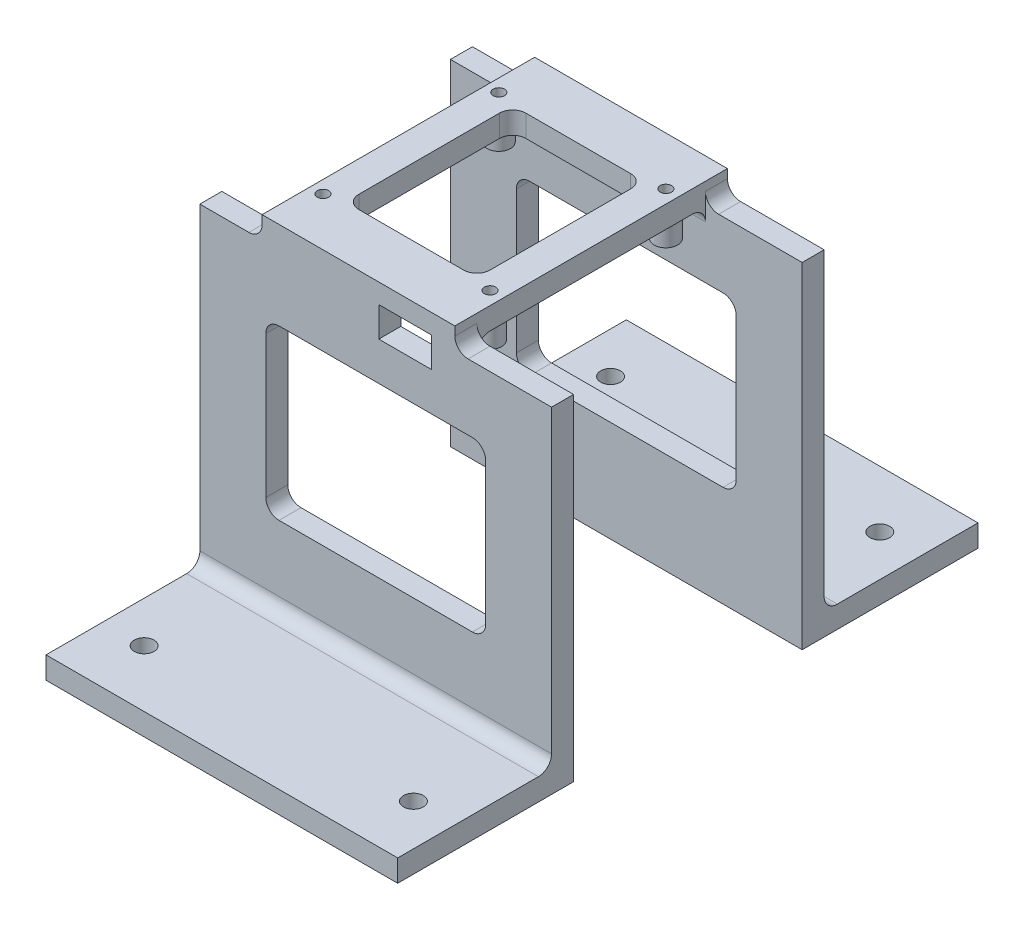
from build123d import *

# Parameters (mm, degrees)
SKETCH1_W               = 80
SKETCH1_H               = 40
SKETCH1_R               = 2.25
BOSS_EXTRUDE1_DEPTH     = 5
BOSS_EXTRUDE1_2_DEPTH   = 5
SKETCH2_W               = 80
SKETCH2_H               = 5
BOSS_EXTRUDE2_DEPTH     = 71.3
SKETCH3_W               = 43.85
SKETCH3_H               = 62
BOSS_EXTRUDE3_DEPTH     = 5
SKETCH5_W               = 29.85
SKETCH5_H               = 38
CUT_EXTRUDE2_DEPTH      = 10
CUT_EXTRUDE1_REACH      = 114.097
SKETCH4_R               = 1.3
FILLET1_R               = 3
FILLET2_R               = 3
CUT_EXTRUDE3_DEPTH      = 133.735413511
CUT_EXTRUDE3_DEPTH_BACK = 133.735413511
SKETCH6_W               = 50
SKETCH6_H               = 38.3
FILLET3_R               = 3
SKETCH9_R               = 2.65
SKETCH9_R_2             = 1.05
BOSS_EXTRUDE5_DEPTH     = 4.75
SKETCH10_W              = 12
SKETCH10_H              = 6.8
CUT_EXTRUDE4_DEPTH      = 8


with BuildPart() as part:
    # Sketch1 → Boss-Extrude1 (new body)
    with BuildSketch(Plane(origin=(0, 0, 0), x_dir=(1, 0, 0), z_dir=(0, 1, 0))):
        with Locations((0, 46)):
            Rectangle(SKETCH1_W, SKETCH1_H)
        with Locations(Location((-30.625, 53.044055982, 0), (0, 0, 270))):
            Circle(SKETCH1_R, mode=Mode.SUBTRACT)
        with Locations(Location((30.625, 53.044055982, 0), (0, 0, 90))):
            Circle(SKETCH1_R, mode=Mode.SUBTRACT)
    extrude(amount=BOSS_EXTRUDE1_DEPTH)



with BuildPart() as body_2:
    # Sketch1 → Boss-Extrude1 2 (new body)
    with BuildSketch(Plane(origin=(0, 0, 0), x_dir=(1, 0, 0), z_dir=(0, 1, 0))):
        with Locations((0, -46)):
            Rectangle(SKETCH1_W, SKETCH1_H)
        with Locations(Location((30.625, -53.044055982, 0), (0, 0, 270))):
            Circle(SKETCH1_R, mode=Mode.SUBTRACT)
        with Locations(Location((-30.625, -53.044055982, 0), (0, 0, 90))):
            Circle(SKETCH1_R, mode=Mode.SUBTRACT)
    extrude(amount=BOSS_EXTRUDE1_2_DEPTH)


with BuildPart() as part_1:
    add(part.part)

    add(body_2.part)  # Boss-Extrude2 merges body 2
    # Sketch2 → Boss-Extrude2 (add)
    with BuildSketch(Plane(origin=(0, 5, 0), x_dir=(1, 0, 0), z_dir=(0, 1, 0))):
        with Locations((0, 28.5)):
            Rectangle(SKETCH2_W, SKETCH2_H)
        with Locations((0, -28.5)):
            Rectangle(SKETCH2_W, SKETCH2_H)
    extrude(amount=BOSS_EXTRUDE2_DEPTH)

    # Sketch3 → Boss-Extrude3 (add)
    with BuildSketch(Plane(origin=(0, 76.3, 0), x_dir=(1, 0, 0), z_dir=(0, 1, 0))):
        with Locations((-3.925, 0)):
            Rectangle(SKETCH3_W, SKETCH3_H)
    extrude(amount=BOSS_EXTRUDE3_DEPTH)

    # Sketch5 → Cut-Extrude2 (cut)
    with BuildSketch(Plane.XZ.offset(-76.3)):
        with Locations((-3.925, 0)):
            Rectangle(SKETCH5_W, SKETCH5_H)
    extrude(amount=-CUT_EXTRUDE2_DEPTH, mode=Mode.SUBTRACT)

    # Sketch4 → Cut-Extrude1 (cut, up to next)
    with BuildSketch(Plane(origin=(0, 81.3, 0), x_dir=(1, 0, 0), z_dir=(0, 1, 0)), mode=Mode.PRIVATE) as cut_extrude1_sk1:
        with Locations(Location((-23, 20, 0), (0, 0, 270))):
            Circle(SKETCH4_R)
    cut_extrude1_tool1 = extrude(cut_extrude1_sk1.sketch, amount=-CUT_EXTRUDE1_REACH, mode=Mode.PRIVATE) & part_1.part
    # Sketch4 → Cut-Extrude1 (cut, up to next)
    with BuildSketch(Plane(origin=(0, 81.3, 0), x_dir=(1, 0, 0), z_dir=(0, 1, 0)), mode=Mode.PRIVATE) as cut_extrude1_sk2:
        with Locations(Location((15, 20, 0), (0, 0, 270))):
            Circle(SKETCH4_R)
    cut_extrude1_tool2 = extrude(cut_extrude1_sk2.sketch, amount=-CUT_EXTRUDE1_REACH, mode=Mode.PRIVATE) & part_1.part
    # Sketch4 → Cut-Extrude1 (cut, up to next)
    with BuildSketch(Plane(origin=(0, 81.3, 0), x_dir=(1, 0, 0), z_dir=(0, 1, 0)), mode=Mode.PRIVATE) as cut_extrude1_sk3:
        with Locations(Location((15, -20, 0), (0, 0, 270))):
            Circle(SKETCH4_R)
    cut_extrude1_tool3 = extrude(cut_extrude1_sk3.sketch, amount=-CUT_EXTRUDE1_REACH, mode=Mode.PRIVATE) & part_1.part
    # Sketch4 → Cut-Extrude1 (cut, up to next)
    with BuildSketch(Plane(origin=(0, 81.3, 0), x_dir=(1, 0, 0), z_dir=(0, 1, 0)), mode=Mode.PRIVATE) as cut_extrude1_sk4:
        with Locations(Location((-23, -20, 0), (0, 0, 270))):
            Circle(SKETCH4_R)
    cut_extrude1_tool4 = extrude(cut_extrude1_sk4.sketch, amount=-CUT_EXTRUDE1_REACH, mode=Mode.PRIVATE) & part_1.part
    add(cut_extrude1_tool1.solids().sort_by_distance((-23, 81.3, -20))[0], mode=Mode.SUBTRACT)
    add(cut_extrude1_tool2.solids().sort_by_distance((15, 81.3, -20))[0], mode=Mode.SUBTRACT)
    add(cut_extrude1_tool3.solids().sort_by_distance((15, 81.3, 20))[0], mode=Mode.SUBTRACT)
    add(cut_extrude1_tool4.solids().sort_by_distance((-23, 81.3, 20))[0], mode=Mode.SUBTRACT)

    # Fillet1
    fillet1_edges = [part_1.edges().sort_by_distance(p)[0] for p in [
        (0, 5, -31),
        (-3.925, 76.3, -26),
        (-3.925, 76.3, 26),
        (0, 5, 31),
    ]]
    fillet(fillet1_edges, radius=FILLET1_R)

    # Fillet2
    fillet2_edges = [part_1.edges().sort_by_distance(p)[0] for p in [
        (18, 76.3, -28.5),
        (-25.85, 76.3, -28.5),
        (-25.85, 76.3, 28.5),
        (18, 76.3, 28.5),
    ]]
    fillet(fillet2_edges, radius=FILLET2_R)

    # Sketch6 → Cut-Extrude3 (cut, two sides: drawn at the far end of the back side and taken through both)
    with BuildSketch(Plane.XY.offset(31).offset(-CUT_EXTRUDE3_DEPTH_BACK)):
        with Locations((0, 42.15)):
            Rectangle(SKETCH6_W, SKETCH6_H)
    extrude(amount=CUT_EXTRUDE3_DEPTH + CUT_EXTRUDE3_DEPTH_BACK, mode=Mode.SUBTRACT)

    # Fillet3
    fillet3_edges = [part_1.edges().sort_by_distance(p)[0] for p in [
        (-25, 61.3, -28.5),
        (-25, 61.3, 28.5),
        (-25, 23, -28.5),
        (-25, 23, 28.5),
        (25, 23, -28.5),
        (25, 23, 28.5),
        (25, 61.3, -28.5),
        (25, 61.3, 28.5),
        (-18.85, 78.8, -19),
        (-18.85, 78.8, 19),
        (11, 78.8, 19),
        (11, 78.8, -19),
    ]]
    fillet(fillet3_edges, radius=FILLET3_R)

    # Sketch9 → Boss-Extrude5 (add)
    # profile 1 of 4: a face of its own
    with BuildSketch(Plane.XZ.offset(-76.3)):
        with Locations(Location((-23, 20, 0), (0, 0, 270))):
            Circle(SKETCH9_R)
        with Locations(Location((-23, 20, 0), (0, 0, 270))):
            Circle(SKETCH9_R_2, mode=Mode.SUBTRACT)
    # profile 2 of 4: a face of its own
    with BuildSketch(Plane.XZ.offset(-76.3)):
        with Locations(Location((-23, -20, 0), (0, 0, 270))):
            Circle(SKETCH9_R)
        with Locations(Location((-23, -20, 0), (0, 0, 270))):
            Circle(SKETCH9_R_2, mode=Mode.SUBTRACT)
    # profile 3 of 4: a face of its own
    with BuildSketch(Plane.XZ.offset(-76.3)):
        with Locations(Location((15, 20, 0), (0, 0, 270))):
            Circle(SKETCH9_R)
        with Locations(Location((15, 20, 0), (0, 0, 270))):
            Circle(SKETCH9_R_2, mode=Mode.SUBTRACT)
    # profile 4 of 4: a face of its own
    with BuildSketch(Plane.XZ.offset(-76.3)):
        with Locations(Location((15, -20, 0), (0, 0, 270))):
            Circle(SKETCH9_R)
        with Locations(Location((15, -20, 0), (0, 0, 270))):
            Circle(SKETCH9_R_2, mode=Mode.SUBTRACT)
    extrude(amount=BOSS_EXTRUDE5_DEPTH)

    # Sketch10 → Cut-Extrude4 (cut)
    with BuildSketch(Plane.XY.offset(31)):
        with Locations((6.7, 73.45)):
            Rectangle(SKETCH10_W, SKETCH10_H)
    extrude(amount=-CUT_EXTRUDE4_DEPTH, mode=Mode.SUBTRACT)


solid = part_1.part
